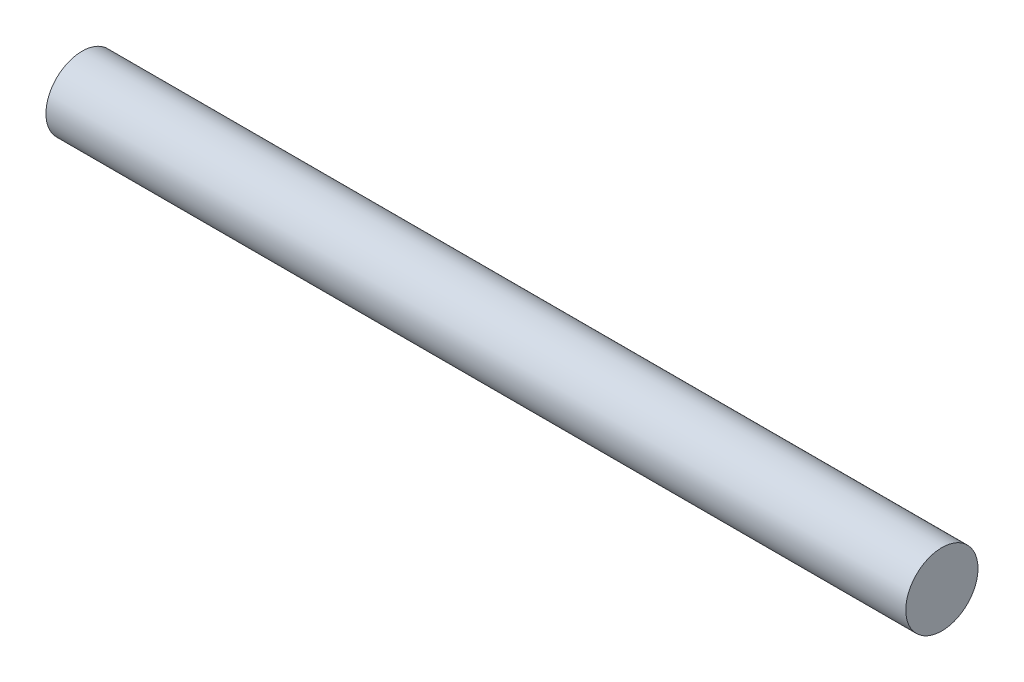
from build123d import *

# Parameters (mm, degrees)
CROQUIS1_R              = 84
CROQUIS1_R_2            = 79
SALIENTE_EXTRUIR1_DEPTH = 2000
CROQUIS2_R              = 84
SALIENTE_EXTRUIR2_DEPTH = 10
SALIENTE_EXTRUIR3_START = -10
CROQUIS3_R              = 84
SALIENTE_EXTRUIR3_DEPTH = 10


with BuildPart() as part:
    # Croquis1 → Saliente-Extruir1 (new body)
    with BuildSketch(Plane(origin=(0, 0, 0), x_dir=(0, 0, -1), z_dir=(1, 0, 0))):
        Circle(CROQUIS1_R)
        Circle(CROQUIS1_R_2, mode=Mode.SUBTRACT)
    extrude(amount=SALIENTE_EXTRUIR1_DEPTH)

    # Croquis2 → Saliente-Extruir2 (add)
    with BuildSketch(Plane.ZY):
        with Locations(Location((0, 0, 0), (0, 0, 180))):
            Circle(CROQUIS2_R)
    extrude(amount=-SALIENTE_EXTRUIR2_DEPTH)

    # Croquis3 → Saliente-Extruir3 (add)
    with BuildSketch(Plane(origin=(2000, 0, 0), x_dir=(0, 0, -1), z_dir=(1, 0, 0)).offset(SALIENTE_EXTRUIR3_START)):
        Circle(CROQUIS3_R)
    extrude(amount=SALIENTE_EXTRUIR3_DEPTH)


solid = part.part
